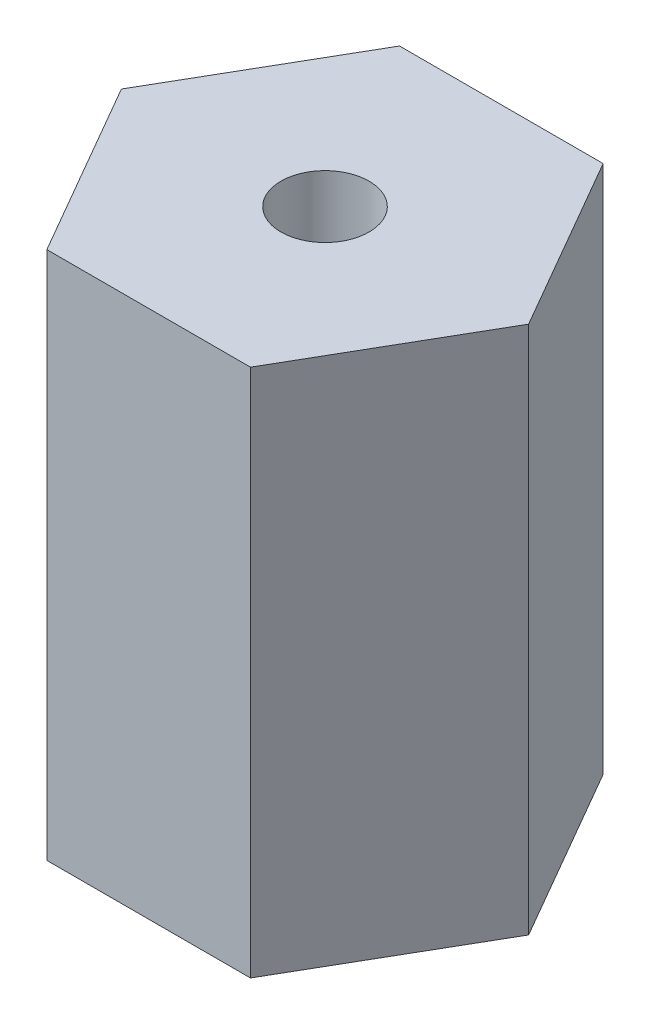
from build123d import *

# Parameters (mm, degrees)
SKETCH1_R           = 2.5
BOSS_EXTRUDE1_DEPTH = 30


with BuildPart() as part:
    # Sketch1 → Boss-Extrude1 (new body)
    with BuildSketch(Plane(origin=(0, 0, 0), x_dir=(1, 0, 0), z_dir=(0, 1, 0))):
        Polygon((-3.363248654, 5.825317547), (-9.136751346, 15.825317547), (-20.68375673, 15.825317547), (-26.457259422, 5.825317547), (-20.68375673, -4.174682453), (-9.136751346, -4.174682453), align=None)
        with Locations(Location((-14.910254038, 5.825317547, 0), (0, 0, 270))):
            Circle(SKETCH1_R, mode=Mode.SUBTRACT)
    extrude(amount=BOSS_EXTRUDE1_DEPTH)


solid = part.part
